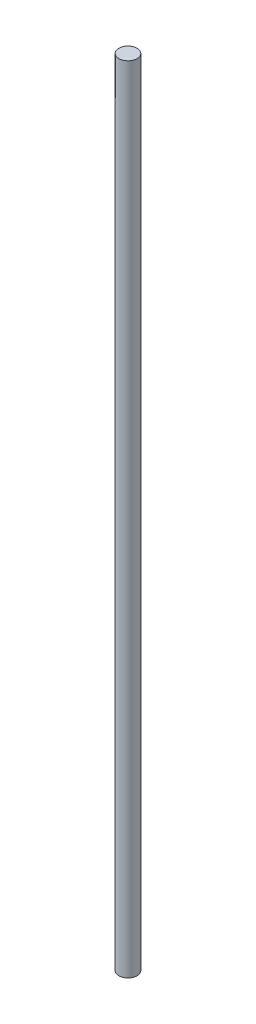
from build123d import *

# Parameters (mm, degrees)
ESQUISSE1_R        = 3
BOSS_EXTRU_1_DEPTH = 263


with BuildPart() as part:
    # Esquisse1 → Boss.-Extru.1 (new body)
    with BuildSketch(Plane(origin=(0, 0, 0), x_dir=(1, 0, 0), z_dir=(0, 1, 0))):
        with Locations(Location((0, 0, 0), (0, 0, 270))):
            Circle(ESQUISSE1_R)
    extrude(amount=BOSS_EXTRU_1_DEPTH)


solid = part.part
